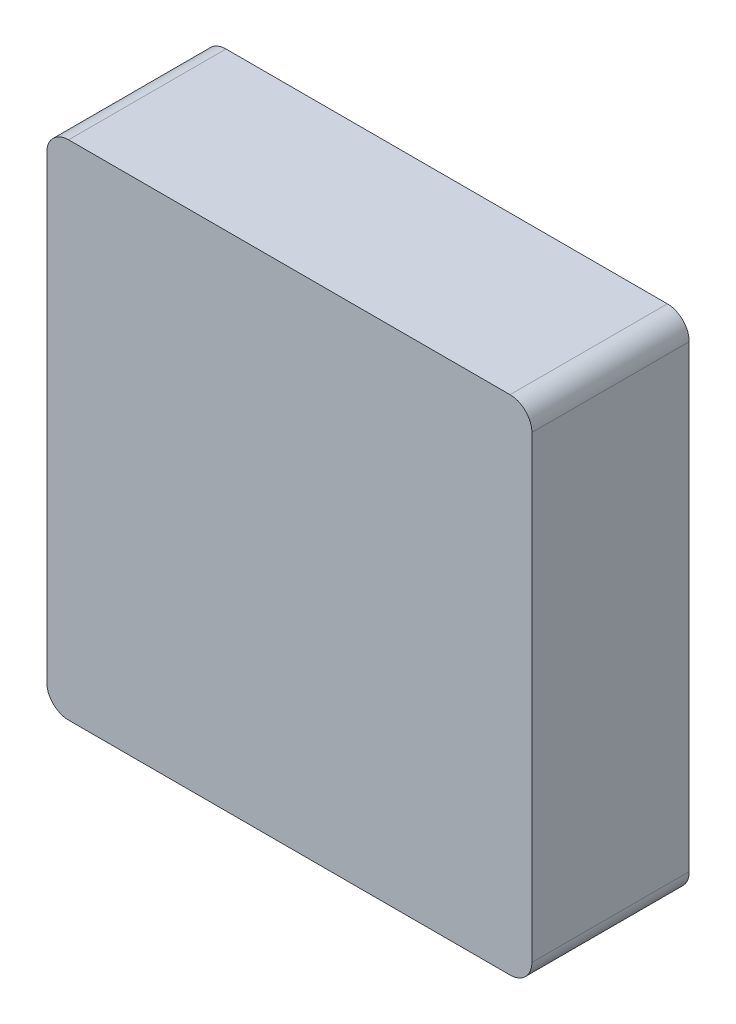
from build123d import *

# Parameters (mm, degrees)
SKETCH_1_W      = 111
SKETCH_1_H      = 115
EXTRUDE_1_DEPTH = 36
FILLET_1_R      = 5


with BuildPart() as part:
    # ｽｹｯﾁ1 → ﾎﾞｽ - 押し出し1 (new body)
    with BuildSketch(Plane.XY):
        Rectangle(SKETCH_1_W, SKETCH_1_H)
    extrude(amount=EXTRUDE_1_DEPTH)

    # ﾌｨﾚｯﾄ1
    fillet_1_edges = [part.edges().sort_by_distance(p)[0] for p in [
        (55.5, -57.5, 18),
        (-55.5, -57.5, 18),
        (-55.5, 57.5, 18),
        (55.5, 57.5, 18),
    ]]
    fillet(fillet_1_edges, radius=FILLET_1_R)


solid = part.part
